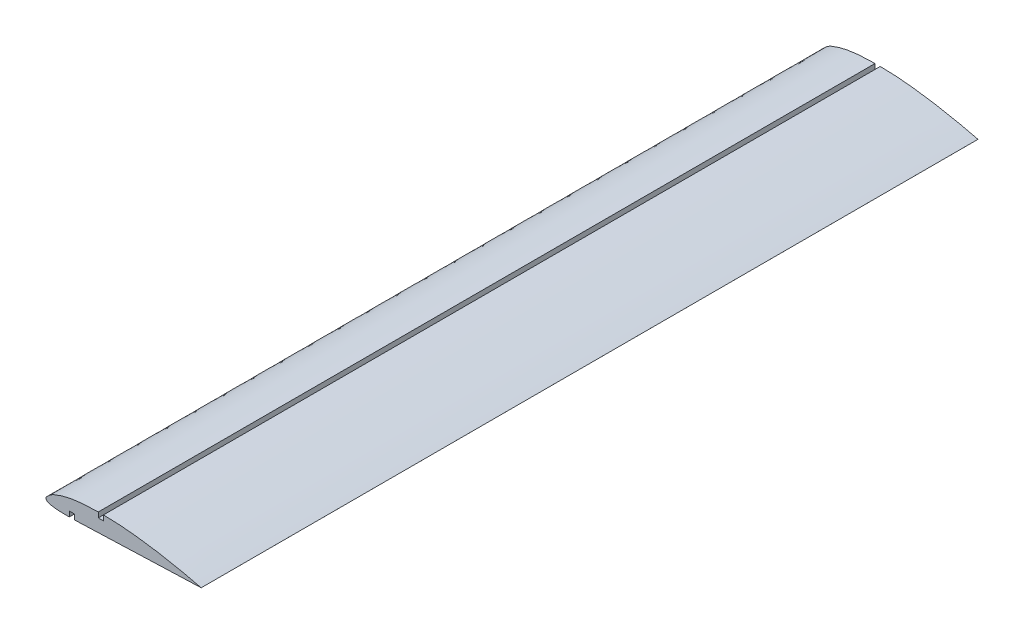
from build123d import *

# Parameters (mm, degrees)
BOSS_EXTRUDE1_DEPTH = 750
CUT_EXTRUDE1_DEPTH  = 792


with BuildPart() as part:
    # Sketch1 → Boss-Extrude1 (new body)
    with BuildSketch(Plane.XY):
        with BuildLine():
            Line((149.858113324, 0), (149.855835651, -0.00867133))
            add(Edge.make_bspline(
                [(149.858113324, 0), (148.064864637, 0.471027481), (143.224769961, 1.742362118), (133.175670914, 3.886034627), (119.499496989, 6.758253215), (102.541429982, 9.744438365), (85.964517719, 11.956268792), (70.816843468, 13.313775138), (56.667826786, 13.848112216), (41.764744871, 13.642732387), (27.878301368, 12.538757837), (17.516862727, 10.350224421), (10.936048166, 8.121191966), (5.628206266, 6.017279046), (2.240759138, 3.159947775), (-0.293696922, 0.719700584), (0.542306535, -2.400763115), (4.956625023, -3.537663372), (10.612229447, -4.327824942), (18.770818109, -4.498199411), (30.500536827, -4.493359859), (45.784466548, -3.912234803), (66.370760986, -3.122790256), (87.01625275, -2.378102064), (108.487999193, -1.576150156), (124.547177916, -1.002761448), (137.784916862, -0.521876849), (145.122318881, -0.266429976), (148.916898874, -0.059994798), (149.855835651, -0.00867133)],
                knots=[0, 0, 0, 0, 0.018163138, 0.049023492, 0.100643645, 0.155079573, 0.217678279, 0.264435784, 0.304025298, 0.356345356, 0.410393025, 0.44030719, 0.459595641, 0.478843318, 0.494821298, 0.504998978, 0.508601056, 0.524256235, 0.542615557, 0.567476747, 0.602874089, 0.658123072, 0.717036036, 0.804816302, 0.860486783, 0.927555311, 0.962250043, 0.990268591, 0.999481252, 0.999481252, 0.999481252, 0.999481252], degree=3))
        make_face()
    extrude(amount=BOSS_EXTRUDE1_DEPTH)

    # Sketch2 → Cut-Extrude1 (cut)
    with BuildSketch(Plane(origin=(0, 0, 0), x_dir=(-1, 0, 0), z_dir=(0, 0, -1))):
        Polygon((-22.50427157, -4.484133504), (-22.50427157, 0.545272615), (-27.50427157, 0.545272615), (-27.50427157, -4.454727385), (-27.50427157, -6.853720537), (-22.50427157, -6.853720537), align=None)
        Polygon((-50.473830582, 13.72149366), (-50.473830582, 8.72149366), (-55.473830582, 8.72149366), (-55.473830582, 13.736673966), (-55.473830582, 14.869787579), (-50.473830582, 14.869787579), align=None)
    extrude(amount=-CUT_EXTRUDE1_DEPTH, mode=Mode.SUBTRACT)


solid = part.part
